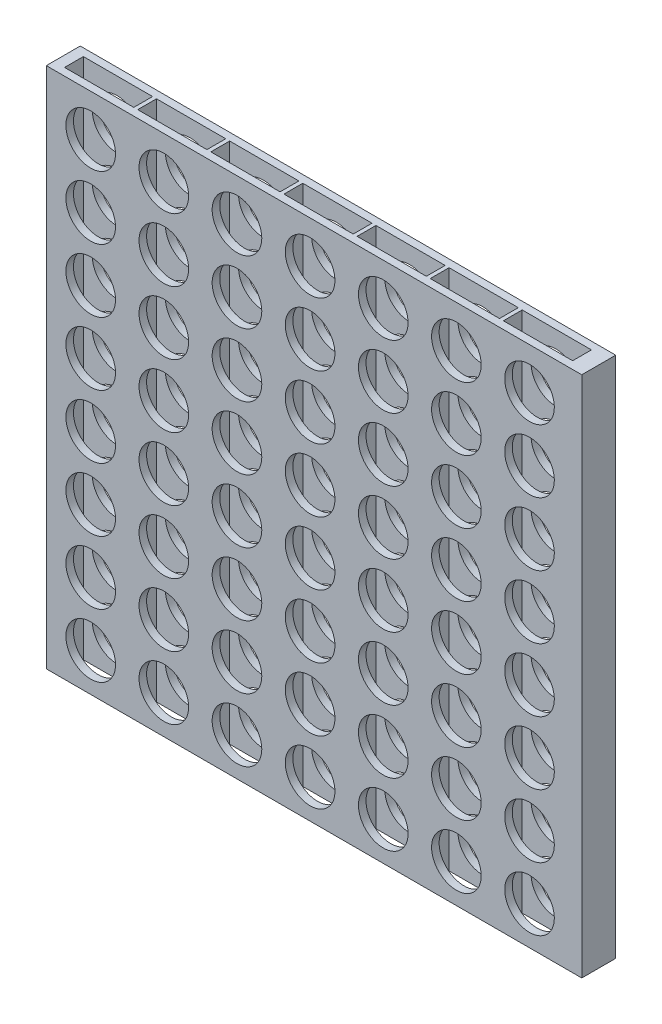
from build123d import *

# Parameters (mm, degrees)
SKETCH1_W            = 260.35
SKETCH1_H            = 16.51
BOSS_EXTRUDE1_DEPTH  = 254
SKETCH2_W            = 33.655
SKETCH2_H            = 9.144
CUT_EXTRUDE1_DEPTH   = 286.534018376
LPATTERN1_COUNT      = 7
LPATTERN1_PITCH      = 35.56
SKETCH3_R            = 12.065
CUT_EXTRUDE2_DEPTH   = 286.891781493
LPATTERN2_COUNT      = 7
LPATTERN2_PITCH      = 35.56
LPATTERN2_COUNT_DIR2 = 8
LPATTERN2_PITCH_DIR2 = 30.734


with BuildPart() as part:
    # Sketch1 → Boss-Extrude1 (new body)
    with BuildSketch(Plane(origin=(0, 0, 0), x_dir=(1, 0, 0), z_dir=(0, 1, 0))):
        Rectangle(SKETCH1_W, SKETCH1_H)
    extrude(amount=BOSS_EXTRUDE1_DEPTH)

    # Sketch2 → Cut-Extrude1 (cut, through all)
    with BuildSketch(Plane(origin=(0, 254, 0), x_dir=(1, 0, 0), z_dir=(0, 1, 0))):
        with Locations((-108.1405, 0)):
            Rectangle(SKETCH2_W, SKETCH2_H)
    cut_extrude1 = extrude(amount=-CUT_EXTRUDE1_DEPTH, mode=Mode.SUBTRACT)

    # LPattern1: Cut-Extrude1 ×7
    with Locations(*[(i * LPATTERN1_PITCH, 0, 0) for i in range(1, LPATTERN1_COUNT)]):
        add(cut_extrude1, mode=Mode.SUBTRACT)

    # Sketch3 → Cut-Extrude2 (cut, through all)
    with BuildSketch(Plane.XY.offset(8.255)):
        with Locations((-108.585, 233.68)):
            Circle(SKETCH3_R)
    cut_extrude2 = extrude(amount=-CUT_EXTRUDE2_DEPTH, mode=Mode.SUBTRACT)

    # LPattern2: Cut-Extrude2 7 × 8
    with Locations(*[(i * LPATTERN2_PITCH, -j * LPATTERN2_PITCH_DIR2, 0) for i in range(LPATTERN2_COUNT) for j in range(LPATTERN2_COUNT_DIR2) if (i, j) != (0, 0)]):
        add(cut_extrude2, mode=Mode.SUBTRACT)


solid = part.part
